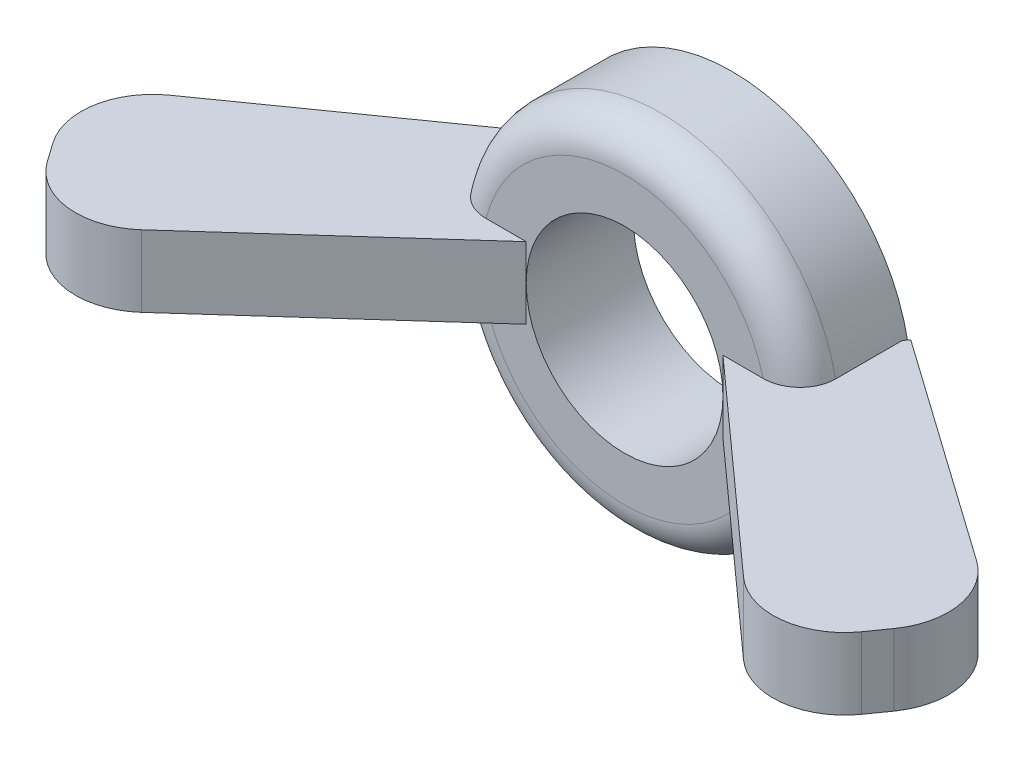
from build123d import *

# Parameters (mm, degrees)
ESQUISSE1_R             = 5
ESQUISSE1_R_2           = 2.75
BOSS_EXTRU_1_DEPTH      = 3
BOSS_EXTRU_2_DEPTH      = 1
BOSS_EXTRU_2_DEPTH_BACK = 1
CONG_1_R                = 1


with BuildPart() as part:
    # Esquisse1 → Boss.-Extru.1 (new body)
    with BuildSketch(Plane.XY):
        Circle(ESQUISSE1_R)
        Circle(ESQUISSE1_R_2, mode=Mode.SUBTRACT)
    extrude(amount=BOSS_EXTRU_1_DEPTH)

    # Esquisse2 → Boss.-Extru.2 (add, two sides: drawn at the far end of the back side and taken through both)
    with BuildSketch(Plane(origin=(0, 0, 0), x_dir=(1, 0, 0), z_dir=(0, 1, 0)).offset(-BOSS_EXTRU_2_DEPTH_BACK)):
        with BuildLine():
            Line((-5, 0), (-11.278292154, -4.43596899))
            ThreePointArc((-11.278292154, -4.43596899), (-12.095263684, -5.73045857), (-11.757607433, -7.223487038))
            Line((-11.757607433, -7.223487038), (-11.382926754, -7.753778113))
            ThreePointArc((-11.382926754, -7.753778113), (-9.972806189, -8.587172352), (-8.41291055, -8.087460876))
            Line((-8.41291055, -8.087460876), (-2.75, -3))
            Line((-2.75, -3), (-5, 0))
        make_face()
        with BuildLine():
            Line((8.41291055, -8.087460876), (2.75, -3))
            Line((2.75, -3), (5, 0))
            Line((5, 0), (11.278292154, -4.43596899))
            ThreePointArc((11.278292154, -4.43596899), (12.095263684, -5.73045857), (11.757607433, -7.223487038))
            Line((11.757607433, -7.223487038), (11.382926754, -7.753778113))
            ThreePointArc((11.382926754, -7.753778113), (9.972806189, -8.587172352), (8.41291055, -8.087460876))
        make_face()
    extrude(amount=BOSS_EXTRU_2_DEPTH + BOSS_EXTRU_2_DEPTH_BACK)

    # Congé1
    cong_1_edges = [part.edges().sort_by_distance(p)[0] for p in [
        (0, 5, 3),
        (0, -5, 3),
    ]]
    fillet(cong_1_edges, radius=CONG_1_R)


solid = part.part
